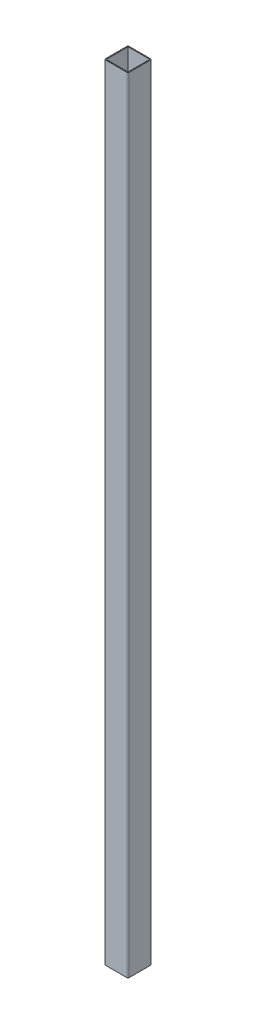
from build123d import *

# Parameters (mm, degrees)
F_8639_82_150_X_150_X_7_0_1_DEPTH = 5307


with BuildPart() as part:
    # Sketch1 → Квадратная труба гост 8639-82 150 X 150 X 7.0(1) (new body)
    with BuildSketch(Plane.XZ):
        with BuildLine():
            Line((-73.999, -80), (73.999, -80))
            ThreePointArc((73.999, -80), (78.242347794, -78.242347794), (80, -73.999))
            Line((80, -73.999), (80, 73.999))
            ThreePointArc((80, 73.999), (78.242347794, 78.242347794), (73.999, 80))
            Line((73.999, 80), (-73.999, 80))
            ThreePointArc((-73.999, 80), (-78.242347794, 78.242347794), (-80, 73.999))
            Line((-80, 73.999), (-80, -73.999))
            ThreePointArc((-80, -73.999), (-78.242347794, -78.242347794), (-73.999, -80))
        make_face()
        with BuildLine():
            Line((-73.999, -74), (73.999, -74))
            ThreePointArc((73.999, -74), (73.999707107, -73.999707107), (74, -73.999))
            Line((74, -73.999), (74, 73.999))
            ThreePointArc((74, 73.999), (73.999707107, 73.999707107), (73.999, 74))
            Line((73.999, 74), (-73.999, 74))
            ThreePointArc((-73.999, 74), (-73.999707107, 73.999707107), (-74, 73.999))
            Line((-74, 73.999), (-74, -73.999))
            ThreePointArc((-74, -73.999), (-73.999707107, -73.999707107), (-73.999, -74))
        make_face(mode=Mode.SUBTRACT)
    extrude(amount=F_8639_82_150_X_150_X_7_0_1_DEPTH)


solid = part.part
